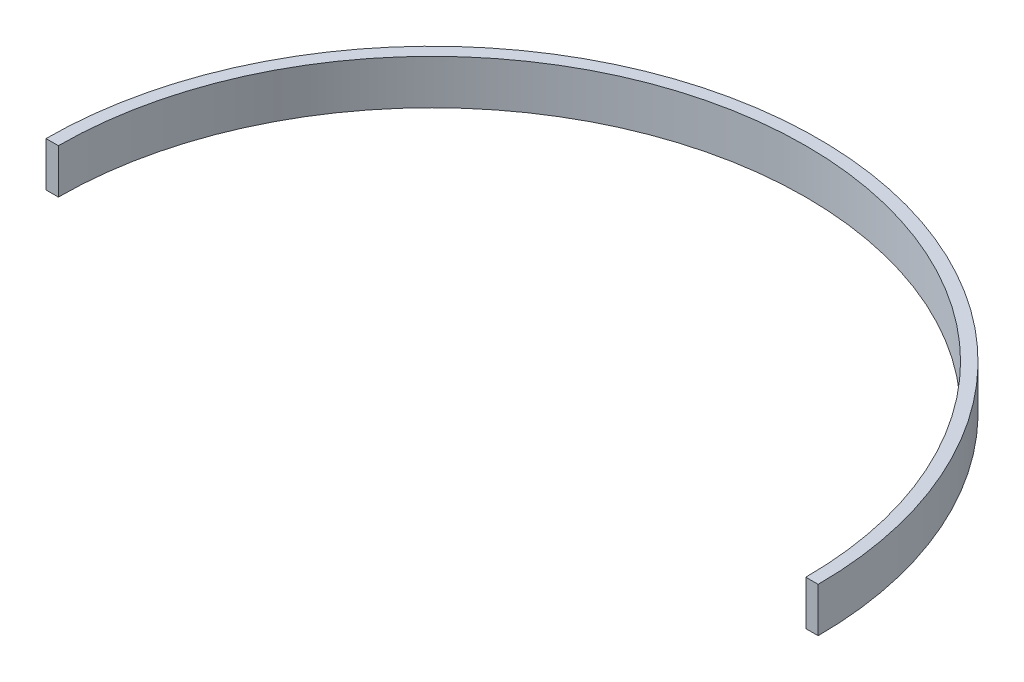
from build123d import *

# Parameters (mm, degrees)
BOSS_EXTRUDE1_DEPTH = 4.5


with BuildPart() as part:
    # Sketch2 → Boss-Extrude1 (new, symmetric)
    with BuildSketch(Plane(origin=(0, 0, 0), x_dir=(1, 0, 0), z_dir=(0, 1, 0))):
        with BuildLine():
            Line((-75.5, 0), (-78, 0))
            ThreePointArc((-78, 0), (0, 78), (78, 0))
            Line((78, 0), (75.5, 0))
            ThreePointArc((75.5, 0), (0, 75.5), (-75.5, 0))
        make_face()
    extrude(amount=BOSS_EXTRUDE1_DEPTH, both=True)


solid = part.part
